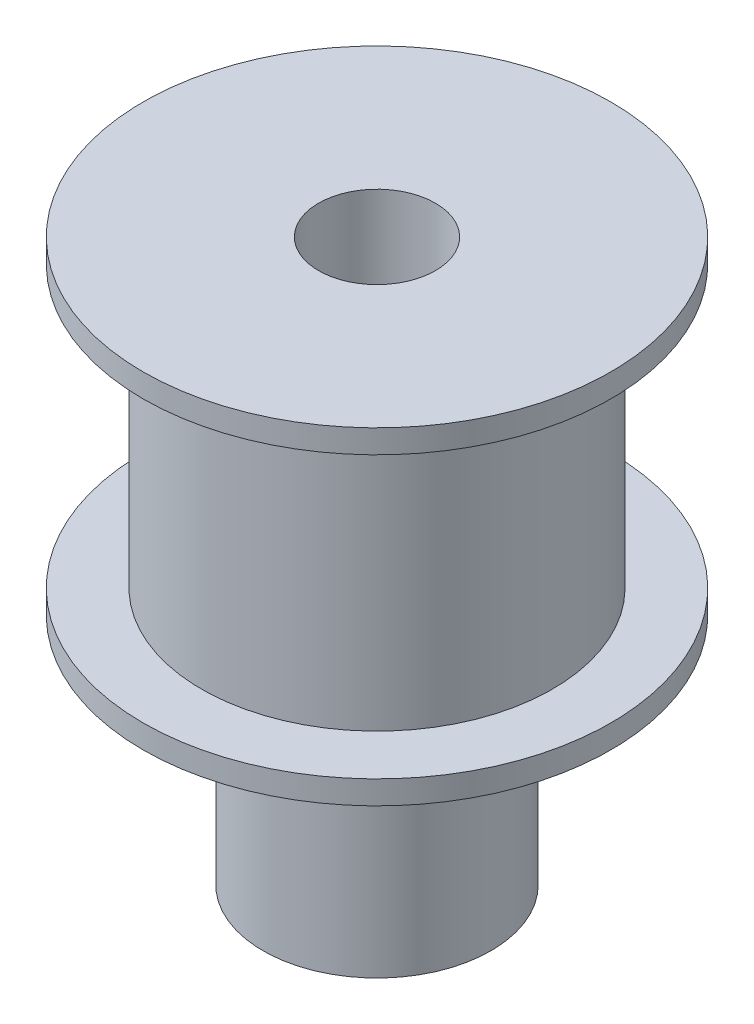
from build123d import *


with BuildPart() as part:
    # Sketch1 → Revolve1 (revolve)
    with BuildSketch(Plane.XY, mode=Mode.PRIVATE) as revolve1_sk:
        Polygon((-2.5, 0), (-2.5, 24), (-10, 24), (-10, 23), (-7.5, 23), (-7.5, 11), (-10, 11), (-10, 10), (-4.875, 10), (-4.875, 0), align=None)
    revolve(revolve1_sk.sketch.rotate(Axis((0, 0, 0), (0, 1, 0)), 270), axis=Axis((0, 0, 0), (0, 1, 0)))


solid = part.part
